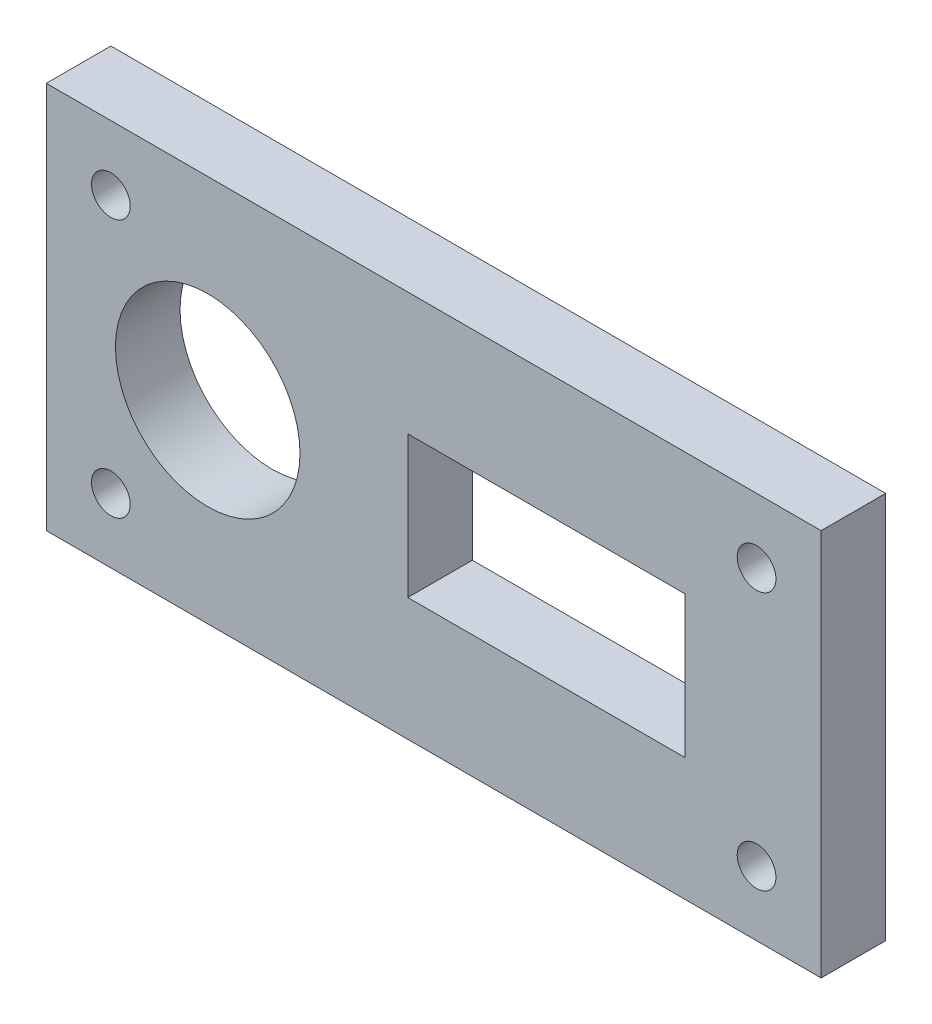
from build123d import *

# Parameters (mm, degrees)
CROQUIS1_W              = 120
CROQUIS1_H              = 60
SALIENTE_EXTRUIR1_DEPTH = 10
CROQUIS2_R              = 14.29
CROQUIS2_R_2            = 4.5
CORTAR_EXTRUIR1_DEPTH   = 68.823299831
CROQUIS3_W              = 42.957247878
CROQUIS3_H              = 21.957247878
CORTAR_EXTRUIR2_DEPTH   = 68.823299831
CROQUIS4_R              = 1.5
CORTAR_EXTRUIR3_DEPTH   = 8
CROQUIS5_W              = 40
CROQUIS5_H              = 60
SALIENTE_EXTRUIR2_DEPTH = 10
CROQUIS6_R              = 14.29
CORTAR_EXTRUIR4_DEPTH   = 105.880884817
CROQUIS7_W              = 40
CROQUIS7_H              = 60
CORTAR_EXTRUIR5_DEPTH   = 105.880884817
CROQUIS8_R              = 3
CORTAR_EXTRUIR6_DEPTH   = 68.823299831


with BuildPart() as part:
    # Croquis1 → Saliente-Extruir1 (new body)
    with BuildSketch(Plane.XY):
        Rectangle(CROQUIS1_W, CROQUIS1_H)
    extrude(amount=SALIENTE_EXTRUIR1_DEPTH)

    # Croquis2 → Cortar-Extruir1 (cut, through all)
    with BuildSketch(Plane.XY.offset(10)):
        with Locations((-35, 0)):
            Circle(CROQUIS2_R)
        with Locations((6.9608, 0)):
            Circle(CROQUIS2_R_2)
    extrude(amount=-CORTAR_EXTRUIR1_DEPTH, mode=Mode.SUBTRACT)

    # Croquis3 → Cortar-Extruir2 (cut, through all)
    with BuildSketch(Plane(origin=(0, 0, 0), x_dir=(-1, 0, 0), z_dir=(0, 0, -1))):
        with Locations((-17.4608, 0)):
            Rectangle(CROQUIS3_W, CROQUIS3_H)
    extrude(amount=-CORTAR_EXTRUIR2_DEPTH, mode=Mode.SUBTRACT)

    # Croquis4 → Cortar-Extruir3 (cut)
    with BuildSketch(Plane(origin=(0, 0, 0), x_dir=(-1, 0, 0), z_dir=(0, 0, -1))):
        with Locations((-41.8608, 5)):
            Circle(CROQUIS4_R)
        with Locations((6.9392, 5)):
            Circle(CROQUIS4_R)
        with Locations((6.9392, -5)):
            Circle(CROQUIS4_R)
        with Locations((-41.8608, -5)):
            Circle(CROQUIS4_R)
    extrude(amount=-CORTAR_EXTRUIR3_DEPTH, mode=Mode.SUBTRACT)

    # Croquis5 → Saliente-Extruir2 (add, through all)
    with BuildSketch(Plane.XY.offset(10)):
        with Locations((-80, 0)):
            Rectangle(CROQUIS5_W, CROQUIS5_H)
    extrude(amount=-SALIENTE_EXTRUIR2_DEPTH)

    # Croquis6 → Cortar-Extruir4 (cut, through all)
    with BuildSketch(Plane.XY.offset(10)):
        with Locations((-78.2308, 0)):
            Circle(CROQUIS6_R)
    extrude(amount=-CORTAR_EXTRUIR4_DEPTH, mode=Mode.SUBTRACT)

    # Croquis7 → Cortar-Extruir5 (cut, through all)
    with BuildSketch(Plane.XY.offset(10)):
        with Locations((-80, 0)):
            Rectangle(CROQUIS7_W, CROQUIS7_H)
    extrude(amount=-CORTAR_EXTRUIR5_DEPTH, mode=Mode.SUBTRACT)

    # Croquis8 → Cortar-Extruir6 (cut, through all)
    with BuildSketch(Plane(origin=(0, 0, 0), x_dir=(-1, 0, 0), z_dir=(0, 0, -1))):
        with Locations((-50, 20)):
            Circle(CROQUIS8_R)
        with Locations((50, 20)):
            Circle(CROQUIS8_R)
        with Locations((50, -20)):
            Circle(CROQUIS8_R)
        with Locations((-50, -20)):
            Circle(CROQUIS8_R)
    extrude(amount=-CORTAR_EXTRUIR6_DEPTH, mode=Mode.SUBTRACT)


solid = part.part
